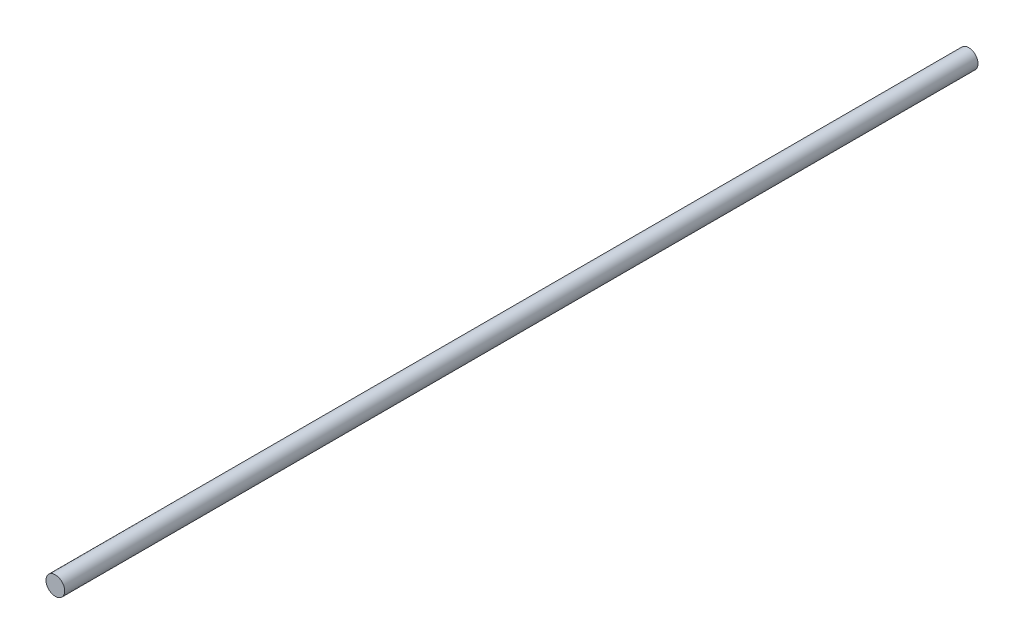
from build123d import *

# Parameters (mm, degrees)
SKETCH2_R           = 4
BOSS_EXTRUDE1_DEPTH = 195


with BuildPart() as part:
    # Sketch2 → Boss-Extrude1 (new, symmetric)
    with BuildSketch(Plane.XY):
        Circle(SKETCH2_R)
    extrude(amount=BOSS_EXTRUDE1_DEPTH, both=True)


solid = part.part
